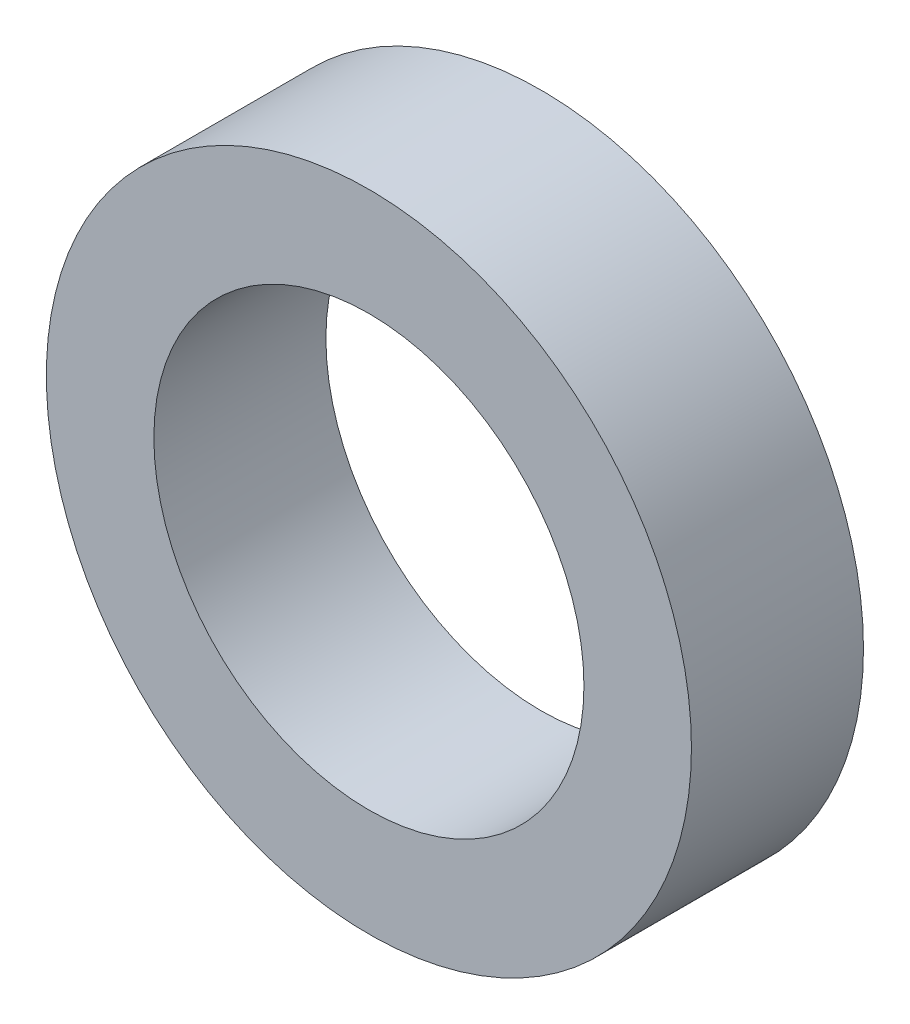
from build123d import *

# Parameters (mm, degrees)
ESQUISSE1_W = 4
ESQUISSE1_H = 2.5


with BuildPart() as part:
    # Esquisse1 → Révolution1 (revolve)
    with BuildSketch(Plane(origin=(0, 0, 0), x_dir=(0, 0, -1), z_dir=(1, 0, 0)), mode=Mode.PRIVATE) as r_volution1_sk:
        with Locations((0, 6.25)):
            Rectangle(ESQUISSE1_W, ESQUISSE1_H)
    revolve(r_volution1_sk.sketch.rotate(Axis((0, 0, 12.934782609), (0, 0, -1)), 90), axis=Axis((0, 0, 12.934782609), (0, 0, -1)))


solid = part.part
